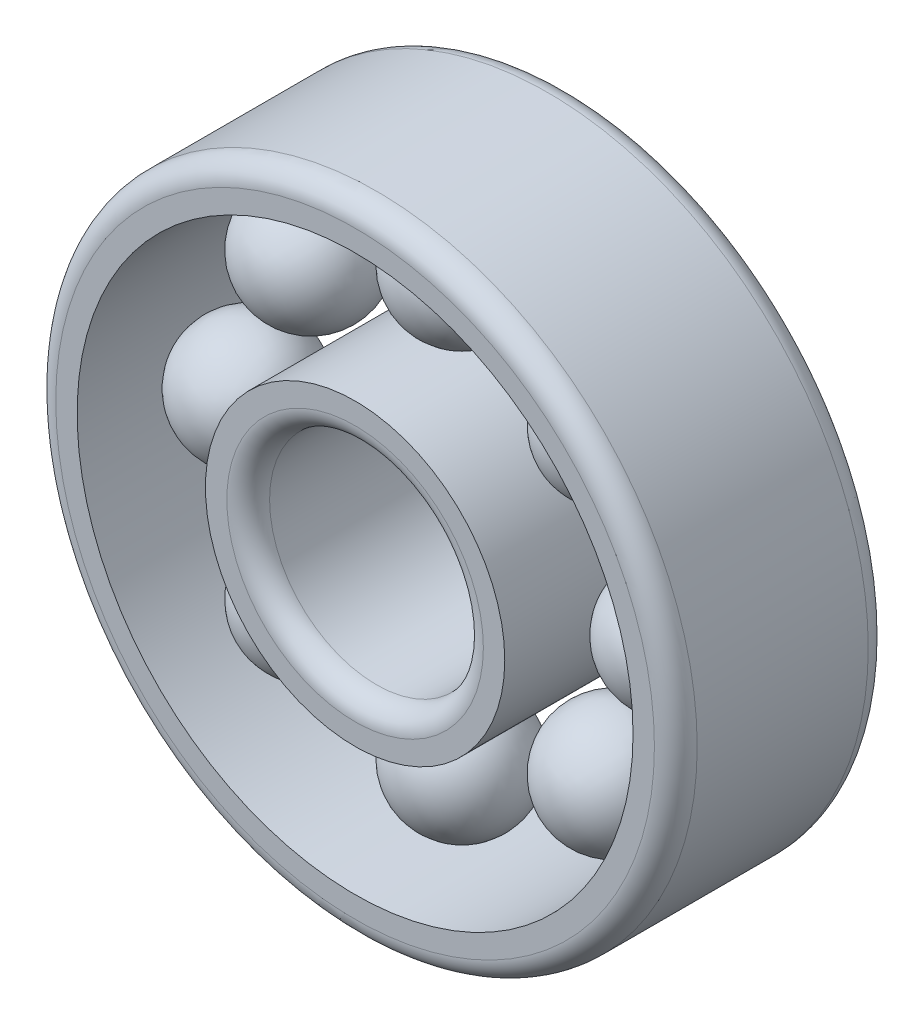
from build123d import *

# Parameters (mm, degrees)
INNERS_W           = 0.2
INNERS_H           = 1
OUTERS_W           = 0.2
OUTERS_H           = 1
BALLSPATTERN_COUNT = 8
FILLET_F1_R        = 0.1
FILLET_F2_R        = 0.1


with BuildPart() as part:
    # InnerS → InnerRing (revolve)
    with BuildSketch(Plane(origin=(0, 0, 0), x_dir=(1, 0, 0), z_dir=(0, 1, 0))):
        with Locations((0.6, 0)):
            Rectangle(INNERS_W, INNERS_H)
    revolve(axis=Axis((0, 0, 1.75), (0, 0, -1)))

    # Fillet F2
    fillet_f2_edges = [part.edges().sort_by_distance(p)[0] for p in [
        (-0.5, 0, -0.5),
        (-0.5, 0, 0.5),
    ]]
    fillet(fillet_f2_edges, radius=FILLET_F2_R)


with BuildPart() as body_2:
    # OuterS → OuterRing (revolve)
    with BuildSketch(Plane(origin=(0, 0, 0), x_dir=(1, 0, 0), z_dir=(0, 1, 0))):
        with Locations((1.4, 0)):
            Rectangle(OUTERS_W, OUTERS_H)
    revolve(axis=Axis((0, 0, 1.75), (0, 0, -1)))

    # Fillet F1
    fillet_f1_edges = [body_2.edges().sort_by_distance(p)[0] for p in [
        (-1.5, 0, -0.5),
        (-1.5, 0, 0.5),
    ]]
    fillet(fillet_f1_edges, radius=FILLET_F1_R)


with BuildPart() as body_3:
    # BallS → Ball (revolve)
    with BuildSketch(Plane(origin=(0, 0, 0), x_dir=(1, 0, 0), z_dir=(0, 1, 0))):
        with BuildLine():
            Line((0.715, 0), (1.285, 0))
            ThreePointArc((1.285, 0), (1, -0.285), (0.715, 0))
        make_face()
    revolve(axis=Axis((0.715, 0, 0), (1, 0, 0)))


with BuildPart() as ballspattern_1:
    # BallsPattern: pattern copy
    add(body_3.part.rotate(Axis((0, 0, -0.55), (0, 0, 1)), 1 * 360 / BALLSPATTERN_COUNT))


with BuildPart() as ballspattern_2:
    # BallsPattern: pattern copy
    add(body_3.part.rotate(Axis((0, 0, -0.55), (0, 0, 1)), 2 * 360 / BALLSPATTERN_COUNT))


with BuildPart() as ballspattern_3:
    # BallsPattern: pattern copy
    add(body_3.part.rotate(Axis((0, 0, -0.55), (0, 0, 1)), 3 * 360 / BALLSPATTERN_COUNT))


with BuildPart() as ballspattern_4:
    # BallsPattern: pattern copy
    add(body_3.part.rotate(Axis((0, 0, -0.55), (0, 0, 1)), 4 * 360 / BALLSPATTERN_COUNT))


with BuildPart() as ballspattern_5:
    # BallsPattern: pattern copy
    add(body_3.part.rotate(Axis((0, 0, -0.55), (0, 0, 1)), 5 * 360 / BALLSPATTERN_COUNT))


with BuildPart() as ballspattern_6:
    # BallsPattern: pattern copy
    add(body_3.part.rotate(Axis((0, 0, -0.55), (0, 0, 1)), 6 * 360 / BALLSPATTERN_COUNT))


with BuildPart() as ballspattern_7:
    # BallsPattern: pattern copy
    add(body_3.part.rotate(Axis((0, 0, -0.55), (0, 0, 1)), 7 * 360 / BALLSPATTERN_COUNT))


solid = Compound([part.part, body_2.part, body_3.part, ballspattern_1.part, ballspattern_2.part, ballspattern_3.part, ballspattern_4.part, ballspattern_5.part, ballspattern_6.part, ballspattern_7.part])
